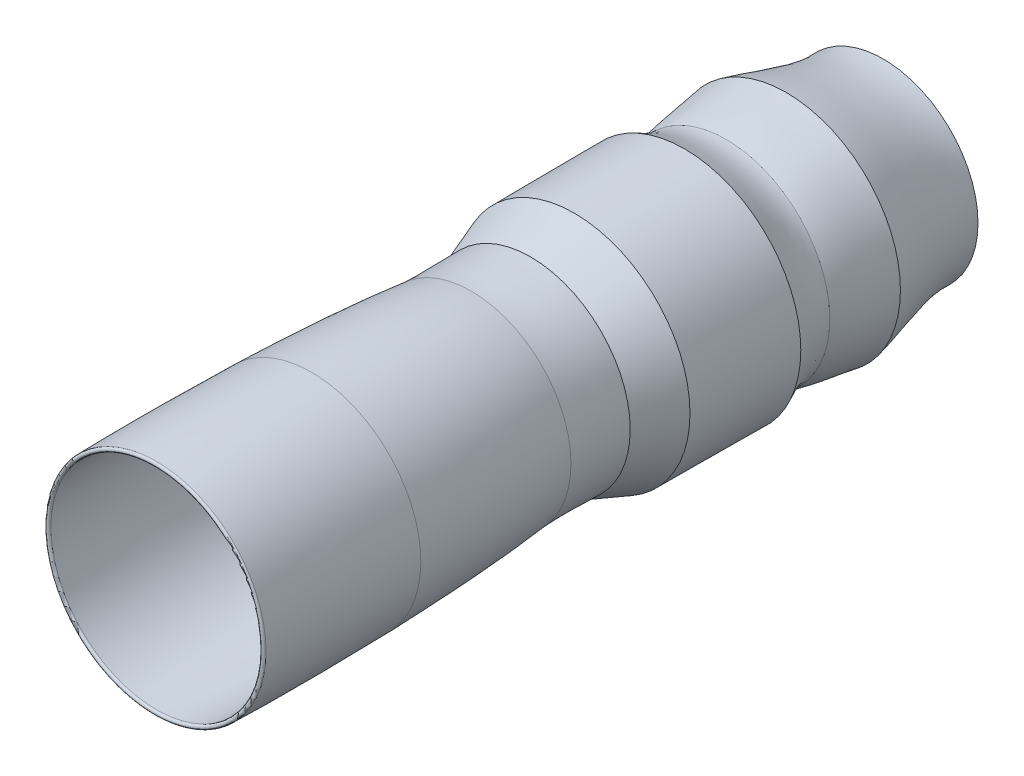
from build123d import *


with BuildPart() as part:
    # Sketch57 → Revolve8 (revolve)
    with BuildSketch(Plane(origin=(0, 0, 0), x_dir=(0, 0, -1), z_dir=(1, 0, 0)), mode=Mode.PRIVATE) as revolve8_sk:
        with BuildLine():
            Line((5548.181582406, 676.772181274), (5549.94392688, 646.823990311))
            add(Edge.make_bspline(
                [(4854.430546947, 784.956999197), (5084.739006328, 731.78880523), (5313.762105926, 632.925530553), (5549.94392688, 646.823990311)],
                knots=[0, 0, 0, 0, 1, 1, 1, 1], degree=3))
            add(Edge.make_bspline(
                [(4430.392997656, 711.434963381), (4568.687044703, 749.566522085), (4711.690743062, 760.575182456), (4854.430546947, 784.956999197)],
                knots=[0, 0, 0, 0, 1, 1, 1, 1], degree=3))
            add(Edge.make_bspline(
                [(4122.346961727, 800.045344329), (4218.881904904, 754.252085999), (4321.241264338, 701.137630049), (4430.392997656, 711.434963381)],
                knots=[0, 0, 0, 0, 1, 1, 1, 1], degree=3))
            Line((4122.346961727, 800.045344329), (3347.188017904, 795.773861826))
            Line((3347.188017904, 795.773861826), (3034.50316193, 681.748596071))
            add(Edge.make_bspline(
                [(2602.82208399, 681.874551433), (2746.45102873, 673.149714518), (2890.10518218, 679.394025232), (3034.50316193, 681.748596071)],
                knots=[0, 0, 0, 0, 1, 1, 1, 1], degree=3))
            add(Edge.make_bspline(
                [(1463.187614253, 750.663022897), (1843.51900635, 737.201686938), (2224.42989756, 724.67912331), (2602.82208399, 681.874551433)],
                knots=[0, 0, 0, 0, 1, 1, 1, 1], degree=3))
            add(Edge.make_bspline(
                [(356.161187989, 753.49429253), (725.110775775, 760.172113123), (1094.102006151, 758.434084399), (1463.187614253, 750.663022897)],
                knots=[0, 0, 0, 0, 1, 1, 1, 1], degree=3))
            ThreePointArc((356.161187989, 753.49429253), (340.892195584, 768.220387427), (355.618290482, 783.489379832))
            add(Edge.make_bspline(
                [(355.618290482, 783.489379832), (447.978600689, 785.161059655), (632.727325383, 787.451178042), (909.823559131, 787.948549261), (1186.921152836, 785.733695063), (1371.672007115, 782.596523982), (1464.033984549, 780.65185155)],
                knots=[0, 0, 0, 0, 0.250048512, 0.500097025, 0.750145537, 1.00019405, 1.00019405, 1.00019405, 1.00019405], degree=3))
            add(Edge.make_bspline(
                [(1464.033984549, 780.65185155), (1511.565607827, 778.96953144), (1606.603392401, 775.635784607), (1796.878112638, 768.592940989), (2034.844014483, 758.175994514), (2272.771260552, 743.160607478), (2439.170853331, 728.9466583), (2534.188579345, 719.58257385), (2581.685151458, 714.454287878), (2605.415796038, 711.772441423)],
                knots=[-0.000188236, -0.000188236, -0.000188236, -0.000188236, 0.124749932, 0.249688101, 0.499564438, 0.749440775, 0.874378944, 0.936848028, 0.999317113, 0.999317113, 0.999317113, 0.999317113], degree=3))
            add(Edge.make_bspline(
                [(2605.415796038, 711.772441423), (2622.881737385, 710.718095399), (2657.822711271, 709.056653333), (2727.907987949, 707.241423031), (2798.260726006, 707.281388372), (2868.927031008, 708.346654655), (2922.088032266, 709.448541621), (2966.53436318, 710.443606043), (3002.173098437, 711.179397469), (3020.036328756, 711.50968168), (3028.96279303, 711.660685991)],
                knots=[0.001824209, 0.001824209, 0.001824209, 0.001824209, 0.125143817, 0.248463426, 0.495102643, 0.618422251, 0.741741859, 0.865061468, 0.926721272, 0.988381076, 0.988381076, 0.988381076, 0.988381076], degree=3))
            Line((3028.96279303, 711.660685991), (3341.808681494, 825.744674681))
            Line((3341.808681494, 825.744674681), (4129.023255708, 830.082589255))
            add(Edge.make_bspline(
                [(4129.023255708, 830.082589255), (4130.550786454, 829.357974854), (4133.599982982, 827.911611235), (4139.745295746, 824.995962528), (4150.522468828, 819.859795459), (4172.070957771, 809.559364708), (4202.900330464, 794.999175573), (4239.95600725, 778.621025859), (4277.04446343, 764.14995496), (4314.111771259, 752.368476013), (4344.940556582, 745.400757086), (4369.568850793, 741.870996984), (4388.032752599, 740.324436864), (4403.432844734, 740.018984614), (4415.766708695, 740.404357827), (4421.956924054, 740.815380432), (4425.042901652, 741.075981857)],
                knots=[-0.021344502, -0.021344502, -0.021344502, -0.021344502, -0.005520898, 0.010302706, 0.041949915, 0.105244332, 0.231833167, 0.358422002, 0.485010836, 0.611599671, 0.738188506, 0.801482923, 0.864777341, 0.928071758, 0.959718967, 0.991366175, 0.991366175, 0.991366175, 0.991366175], degree=3))
            add(Edge.make_bspline(
                [(4425.042901652, 741.075981857), (4433.96738996, 743.514228364), (4451.900494195, 748.184484982), (4487.755854495, 756.694902194), (4532.683351729, 765.979438745), (4586.649789424, 775.45396691), (4640.617499492, 783.770918409), (4694.523324608, 791.428480225), (4748.304857893, 798.917989513), (4792.985306946, 805.424815972), (4824.13715138, 810.324099497), (4839.714487313, 812.890423573), (4848.558960087, 814.386269827), (4853.069120835, 815.158959558), (4855.313198928, 815.54227731)],
                knots=[0.006160434, 0.006160434, 0.006160434, 0.006160434, 0.069141476, 0.132122518, 0.258084602, 0.384046686, 0.51000877, 0.635970855, 0.761932939, 0.887895023, 0.950876065, 0.982366586, 0.998111847, 1.013857107, 1.013857107, 1.013857107, 1.013857107], degree=3))
            add(Edge.make_bspline(
                [(4855.313198928, 815.54227731), (4857.127758647, 815.12337449), (4860.733203268, 814.292241129), (4868.133491042, 812.576596176), (4881.008580579, 809.526163208), (4899.406095254, 805.01094309), (4921.423854439, 799.380997484), (4950.72925746, 791.629753436), (4987.258503845, 781.559982232), (5045.513169984, 764.958688546), (5118.007268377, 743.891870354), (5233.441059702, 712.040625005), (5348.182817178, 686.729597193), (5448.205017504, 676.603538111), (5498.187511924, 675.294194688), (5526.746867618, 675.725036039), (5541.043509267, 676.352131069), (5548.181582406, 676.772181274)],
                knots=[-0.008489417, -0.008489417, -0.008489417, -0.008489417, -0.000610594, 0.00726823, 0.023025877, 0.054541171, 0.086056466, 0.11757176, 0.180602348, 0.243632937, 0.369694114, 0.495755291, 0.747877646, 0.873938823, 0.936969411, 0.968484706, 1, 1, 1, 1], degree=3))
        make_face()
    revolve(revolve8_sk.sketch.rotate(Axis((0, 0, 0), (0, 0, -1)), 90), axis=Axis((0, 0, 0), (0, 0, -1)))


solid = part.part
